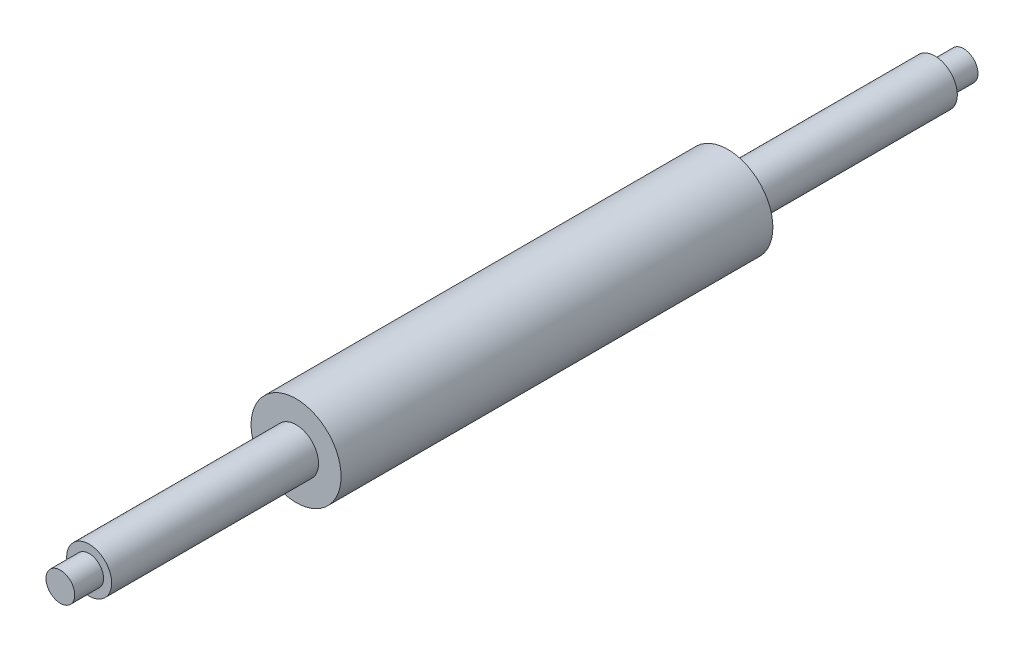
from build123d import *

# Parameters (mm, degrees)
SKETCH3_R           = 12.5
SKETCH3_R_2         = 6.25
BOSS_EXTRUDE1_DEPTH = 60
SKETCH3_3_R         = 6.25
SKETCH3_3_R_2       = 4
BOSS_EXTRUDE2_DEPTH = 117.5
SKETCH3_4_R         = 4
BOSS_EXTRUDE3_DEPTH = 125.5
SKETCH5_R           = 7.5
CUT_EXTRUDE4_DEPTH  = 127.73890484


with BuildPart() as part:
    # Sketch3 → Boss-Extrude1 (new, symmetric)
    with BuildSketch(Plane.XY):
        Circle(SKETCH3_R)
        Circle(SKETCH3_R_2, mode=Mode.SUBTRACT)
    extrude(amount=BOSS_EXTRUDE1_DEPTH, both=True)

    # Sketch3<3> → Boss-Extrude2 (add, symmetric)
    with BuildSketch(Plane.XY):
        Circle(SKETCH3_3_R)
        Circle(SKETCH3_3_R_2, mode=Mode.SUBTRACT)
    extrude(amount=BOSS_EXTRUDE2_DEPTH, both=True)

    # Sketch3<4> → Boss-Extrude3 (add, symmetric)
    with BuildSketch(Plane.XY):
        Circle(SKETCH3_4_R)
    extrude(amount=BOSS_EXTRUDE3_DEPTH, both=True)

    # Sketch5 → Cut-Extrude4 (cut, through all)
    with BuildSketch(Plane(origin=(0, 0, 0), x_dir=(0, 0, -1), z_dir=(1, 0, 0))):
        Circle(SKETCH5_R)
    extrude(amount=-CUT_EXTRUDE4_DEPTH, mode=Mode.SUBTRACT)


solid = part.part
